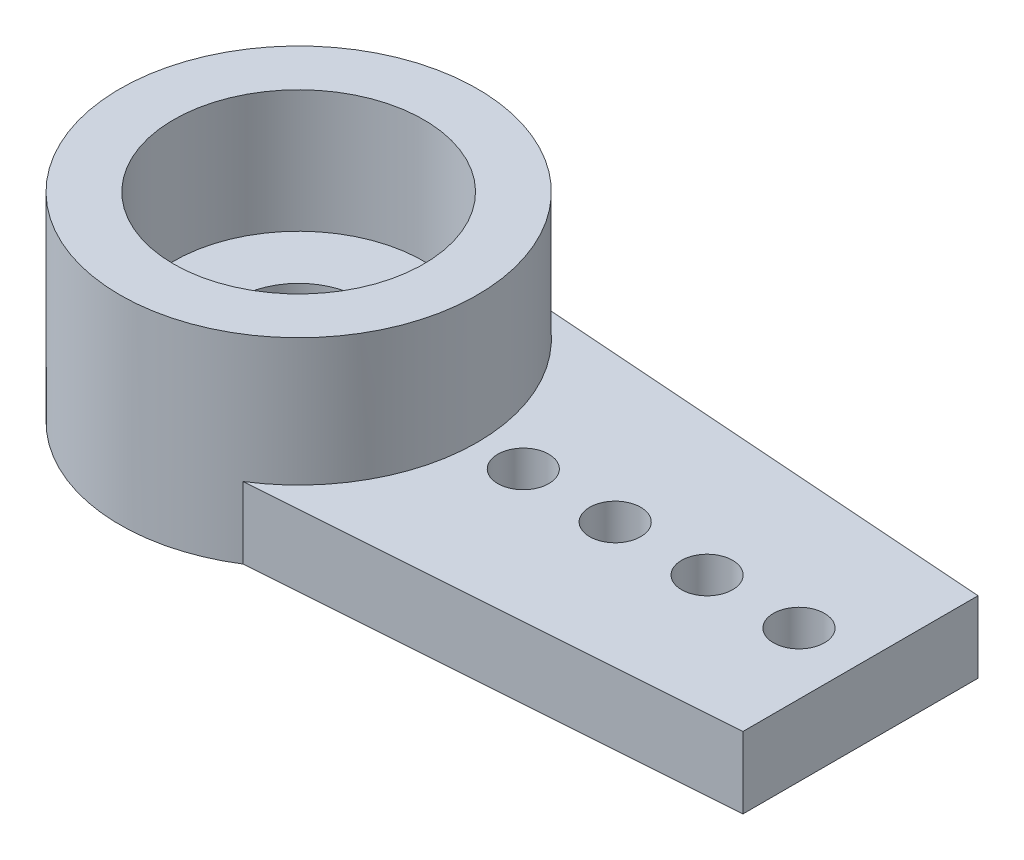
from build123d import *

# Parameters (mm, degrees)
SKETCH1_R           = 0.5
BOSS_EXTRUDE1_DEPTH = 1.4
SKETCH2_R           = 2.35
CUT_EXTRUDE1_DEPTH  = 1
SKETCH3_R           = 3.5
SKETCH3_R_2         = 2.45
BOSS_EXTRUDE2_DEPTH = 2.5
SKETCH4_R           = 1.2
CUT_EXTRUDE2_DEPTH  = 20.282440198
SKETCH5_R           = 2.45
SKETCH5_R_2         = 1.2
BOSS_EXTRUDE3_DEPTH = 0.1
SKETCH6_W           = 35.735260114
SKETCH6_H           = 17.672039004
CUT_EXTRUDE4_DEPTH  = 20.513392837
CUT_EXTRUDE5_DEPTH  = 18.980545042


with BuildPart() as part:
    # Sketch1 → Boss-Extrude1 (new body)
    with BuildSketch(Plane(origin=(0, 0, 0), x_dir=(1, 0, 0), z_dir=(0, 1, 0))):
        with BuildLine():
            Line((-15.2, 2), (-2, 2.95))
            Line((-2, 2.95), (-2, 6.35))
            ThreePointArc((-2, 6.35), (0, 8.35), (2, 6.35))
            Line((2, 6.35), (2, 3.5))
            Line((2, 3.5), (11.004916923, 2.476713986))
            Line((11.004916923, 2.476713986), (11.004916923, -2.476713986))
            Line((11.004916923, -2.476713986), (2, -3.5))
            Line((2, -3.5), (2, -6.35))
            ThreePointArc((2, -6.35), (0, -8.35), (-2, -6.35))
            Line((-2, -6.35), (-2, -2.95))
            Line((-2, -2.95), (-15.2, -2))
            ThreePointArc((-15.2, -2), (-17.2, 0), (-15.2, 2))
        make_face()
        with Locations(Location((0, 6.35, 0), (0, 0, 270))):
            Circle(SKETCH1_R, mode=Mode.SUBTRACT)
        with Locations(Location((0, 4.55, 0), (0, 0, 270))):
            Circle(SKETCH1_R, mode=Mode.SUBTRACT)
        with Locations(Location((0, -4.55, 0), (0, 0, 90))):
            Circle(SKETCH1_R, mode=Mode.SUBTRACT)
        with Locations(Location((0, -6.35, 0), (0, 0, 90))):
            Circle(SKETCH1_R, mode=Mode.SUBTRACT)
        with Locations(Location((-15.2, 0, 0), (0, 0, 270))):
            Circle(SKETCH1_R, mode=Mode.SUBTRACT)
        with Locations(Location((-13.4, 0, 0), (0, 0, 270))):
            Circle(SKETCH1_R, mode=Mode.SUBTRACT)
        with Locations(Location((-11.6, 0, 0), (0, 0, 270))):
            Circle(SKETCH1_R, mode=Mode.SUBTRACT)
        with Locations(Location((-9.8, 0, 0), (0, 0, 270))):
            Circle(SKETCH1_R, mode=Mode.SUBTRACT)
        with Locations(Location((-8, 0, 0), (0, 0, 270))):
            Circle(SKETCH1_R, mode=Mode.SUBTRACT)
        with Locations(Location((-6.2, 0, 0), (0, 0, 270))):
            Circle(SKETCH1_R, mode=Mode.SUBTRACT)
        with Locations(Location((-4.4, 0, 0), (0, 0, 270))):
            Circle(SKETCH1_R, mode=Mode.SUBTRACT)
        with Locations(Location((9.8, 0, 0), (0, 0, 270))):
            Circle(SKETCH1_R, mode=Mode.SUBTRACT)
        with Locations(Location((8, 0, 0), (0, 0, 270))):
            Circle(SKETCH1_R, mode=Mode.SUBTRACT)
        with Locations(Location((6.2, 0, 0), (0, 0, 270))):
            Circle(SKETCH1_R, mode=Mode.SUBTRACT)
        with Locations(Location((4.4, 0, 0), (0, 0, 270))):
            Circle(SKETCH1_R, mode=Mode.SUBTRACT)
    extrude(amount=BOSS_EXTRUDE1_DEPTH)

    # Sketch2 → Cut-Extrude1 (cut)
    with BuildSketch(Plane.XZ):
        with Locations(Location((0, 0, 0), (0, 0, 270))):
            Circle(SKETCH2_R)
    extrude(amount=-CUT_EXTRUDE1_DEPTH, mode=Mode.SUBTRACT)

    # Sketch3 → Boss-Extrude2 (add)
    with BuildSketch(Plane(origin=(0, 1.4, 0), x_dir=(1, 0, 0), z_dir=(0, 1, 0))):
        with Locations(Location((0, 0, 0), (0, 0, 270))):
            Circle(SKETCH3_R)
        with Locations(Location((0, 0, 0), (0, 0, 270))):
            Circle(SKETCH3_R_2, mode=Mode.SUBTRACT)
    extrude(amount=BOSS_EXTRUDE2_DEPTH)

    # Sketch4 → Cut-Extrude2 (cut, through all)
    with BuildSketch(Plane(origin=(0, 1.4, 0), x_dir=(1, 0, 0), z_dir=(0, 1, 0))):
        with Locations(Location((0, 0, 0), (0, 0, 270))):
            Circle(SKETCH4_R)
    extrude(amount=-CUT_EXTRUDE2_DEPTH, mode=Mode.SUBTRACT)

    # Sketch5 → Boss-Extrude3 (add)
    with BuildSketch(Plane(origin=(0, 1.4, 0), x_dir=(1, 0, 0), z_dir=(0, 1, 0))):
        with Locations(Location((0, 0, 0), (0, 0, 270))):
            Circle(SKETCH5_R)
        with Locations(Location((0, 0, 0), (0, 0, 270))):
            Circle(SKETCH5_R_2, mode=Mode.SUBTRACT)
    extrude(amount=BOSS_EXTRUDE3_DEPTH)

    # Sketch6 → Cut-Extrude4 (cut, through all)
    with BuildSketch(Plane.XZ):
        Rectangle(SKETCH6_W, SKETCH6_H)
        with BuildLine():
            Line((-1.868584713, -2.959457918), (-15.2, -2))
            ThreePointArc((-15.2, -2), (-17.2, 0), (-15.2, 2))
            Line((-15.2, 2), (-1.868584713, 2.959457918))
            ThreePointArc((-1.868584713, 2.959457918), (0, 3.5), (1.868584713, 2.959457918))
            Line((1.868584713, 2.959457918), (15.2, 2))
            ThreePointArc((15.2, 2), (17.2, 0), (15.2, -2))
            Line((15.2, -2), (1.868584713, -2.959457918))
            ThreePointArc((1.868584713, -2.959457918), (0, -3.5), (-1.868584713, -2.959457918))
        make_face(mode=Mode.SUBTRACT)
    extrude(amount=-CUT_EXTRUDE4_DEPTH, mode=Mode.SUBTRACT)

    # Sketch7 → Cut-Extrude5 (cut, through all)
    with BuildSketch(Plane.XZ):
        with BuildLine():
            Line((0, 3.5), (-17.731768104, 3.5))
            Line((-17.731768104, 3.5), (-17.731768104, -3.5))
            Line((-17.731768104, -3.5), (0, -3.5))
            ThreePointArc((0, -3.5), (-3.5, 0), (0, 3.5))
        make_face()
    extrude(amount=-CUT_EXTRUDE5_DEPTH, mode=Mode.SUBTRACT)


solid = part.part
